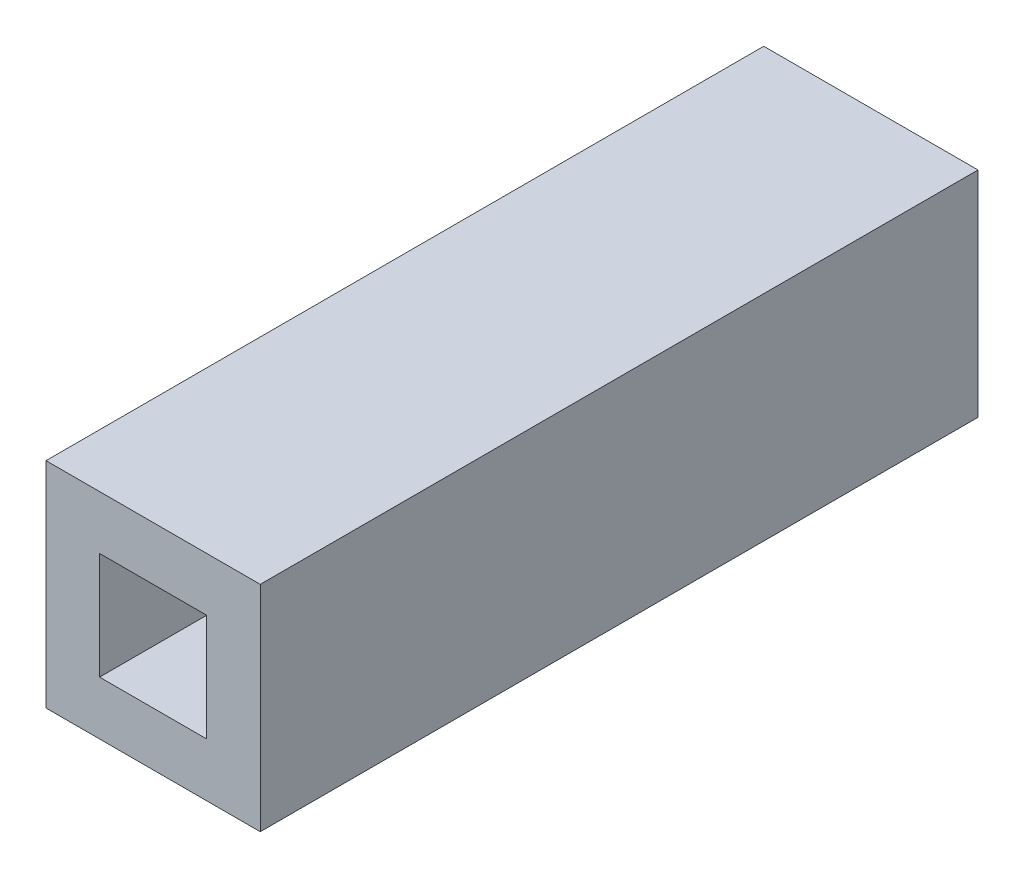
from build123d import *

# Parameters (mm, degrees)
SKETCH1_W           = 20
SKETCH1_H           = 20
SKETCH1_W_2         = 10
SKETCH1_H_2         = 10
EXTRUDE_THIN1_DEPTH = 67


with BuildPart() as part:
    # Sketch1 → Extrude-Thin1 (new body)
    with BuildSketch(Plane.XY):
        Rectangle(SKETCH1_W, SKETCH1_H)
        Rectangle(SKETCH1_W_2, SKETCH1_H_2, mode=Mode.SUBTRACT)
    extrude(amount=EXTRUDE_THIN1_DEPTH)


solid = part.part
